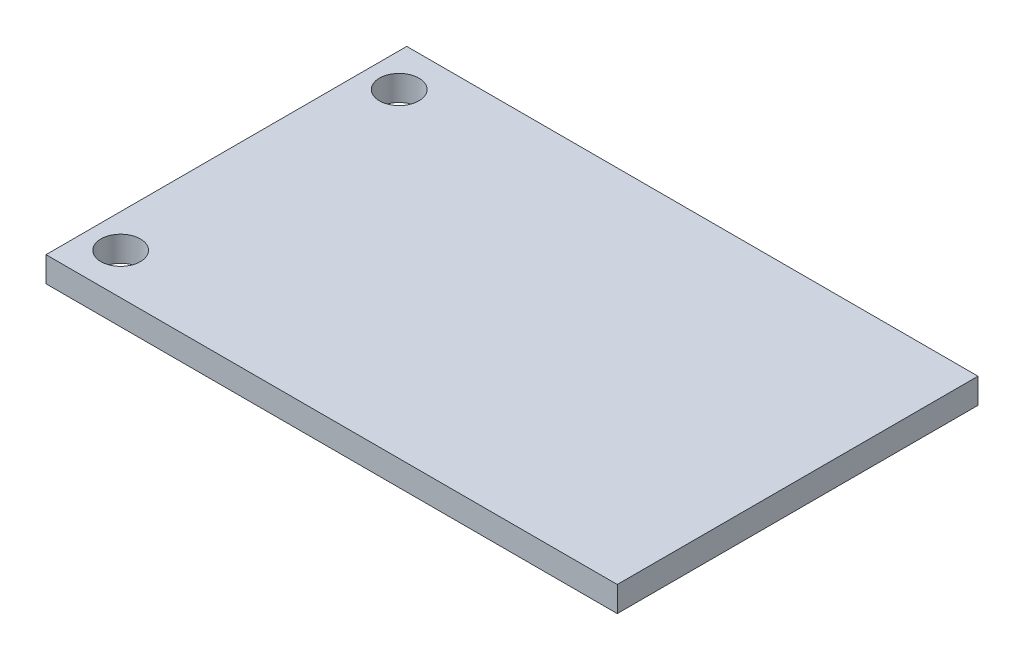
from build123d import *

# Parameters (mm, degrees)
SKETCH1_W           = 36.2
SKETCH1_H           = 22.86
SKETCH1_R           = 1.25
BOSS_EXTRUDE1_DEPTH = 1.6


with BuildPart() as part:
    # Sketch1 → Boss-Extrude1 (new body)
    with BuildSketch(Plane(origin=(0, 0, 0), x_dir=(1, 0, 0), z_dir=(0, 1, 0))):
        Rectangle(SKETCH1_W, SKETCH1_H)
        with Locations(Location((-15.974760747, 8.825, 0), (0, 0, 270))):
            Circle(SKETCH1_R, mode=Mode.SUBTRACT)
        with Locations(Location((-15.974760747, -8.825, 0), (0, 0, 270))):
            Circle(SKETCH1_R, mode=Mode.SUBTRACT)
    extrude(amount=BOSS_EXTRUDE1_DEPTH)


solid = part.part
